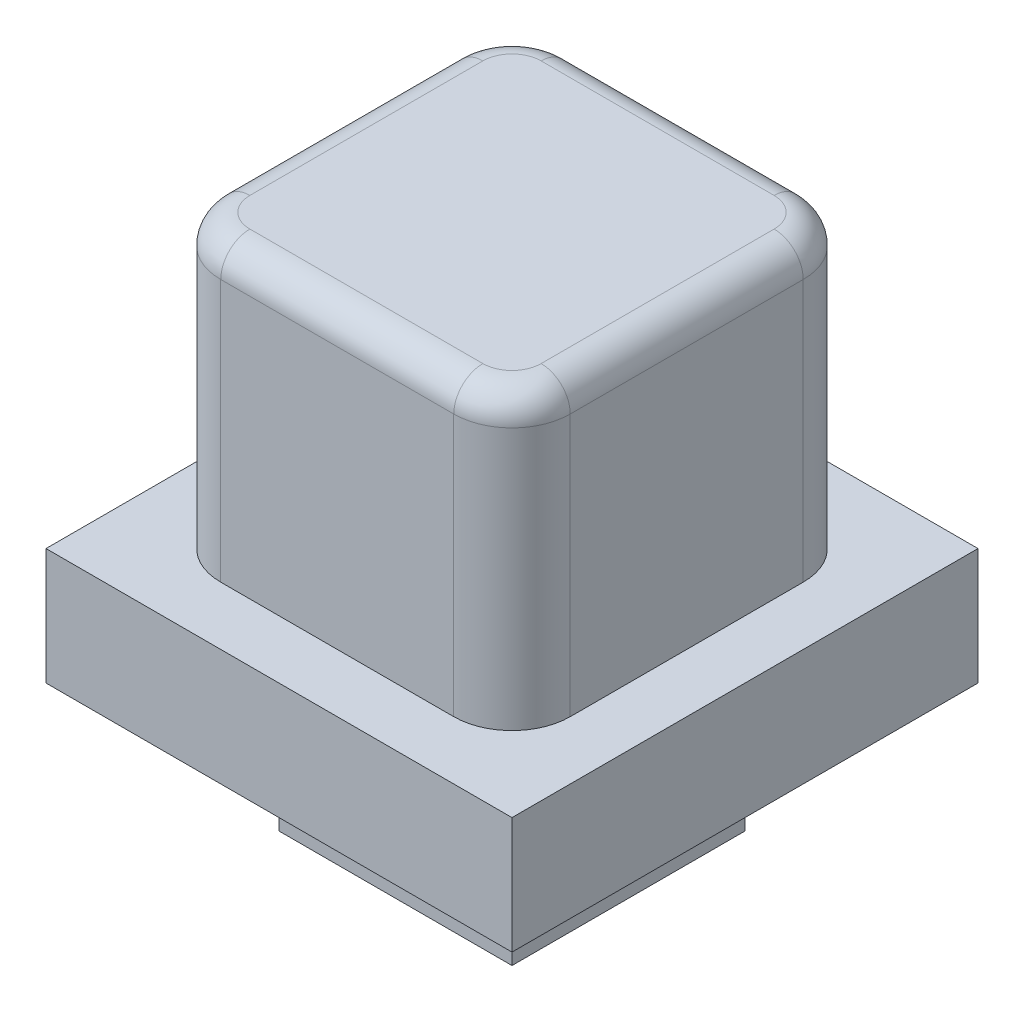
from build123d import *

# Parameters (mm, degrees)
SKETCH1_W           = 8
SKETCH1_H           = 8
BOSS_EXTRUDE1_DEPTH = 2
SKETCH2_W           = 6
SKETCH2_H           = 6
BOSS_EXTRUDE2_DEPTH = 5
FILLET1_R           = 1
SKETCH3_W           = 4
SKETCH3_H           = 4
BOSS_EXTRUDE3_DEPTH = 2.2
FILLET2_R           = 0.5


with BuildPart() as part:
    # Sketch1 → Boss-Extrude1 (new body)
    with BuildSketch(Plane(origin=(0, 0, 0), x_dir=(1, 0, 0), z_dir=(0, 1, 0))):
        Rectangle(SKETCH1_W, SKETCH1_H)
    extrude(amount=BOSS_EXTRUDE1_DEPTH)

    # Sketch2 → Boss-Extrude2 (add)
    with BuildSketch(Plane(origin=(0, 2, 0), x_dir=(1, 0, 0), z_dir=(0, 1, 0))):
        Rectangle(SKETCH2_W, SKETCH2_H)
    extrude(amount=BOSS_EXTRUDE2_DEPTH)

    # Fillet1
    fillet1_edges = [part.edges().sort_by_distance(p)[0] for p in [
        (3, 4.5, 3),
        (3, 4.5, -3),
        (-3, 4.5, -3),
        (-3, 4.5, 3),
    ]]
    fillet(fillet1_edges, radius=FILLET1_R)

    # Sketch3 → Boss-Extrude3 (add)
    with BuildSketch(Plane(origin=(0, 0, 0), x_dir=(-1, 0, 0), z_dir=(0, -1, 0))):
        Rectangle(SKETCH3_W, SKETCH3_H)
    extrude(amount=BOSS_EXTRUDE3_DEPTH)

    # Fillet2
    fillet2_edges = [part.edges().sort_by_distance(p)[0] for p in [
        (3, 7, 0),
        (0, 7, 3),
        (0, 7, -3),
        (-3, 7, 0),
        (-2.707106781, 7, -2.707106781),
        (-2.707106781, 7, 2.707106781),
        (2.707106781, 7, -2.707106781),
        (2.707106781, 7, 2.707106781),
    ]]
    fillet(fillet2_edges, radius=FILLET2_R)


solid = part.part
